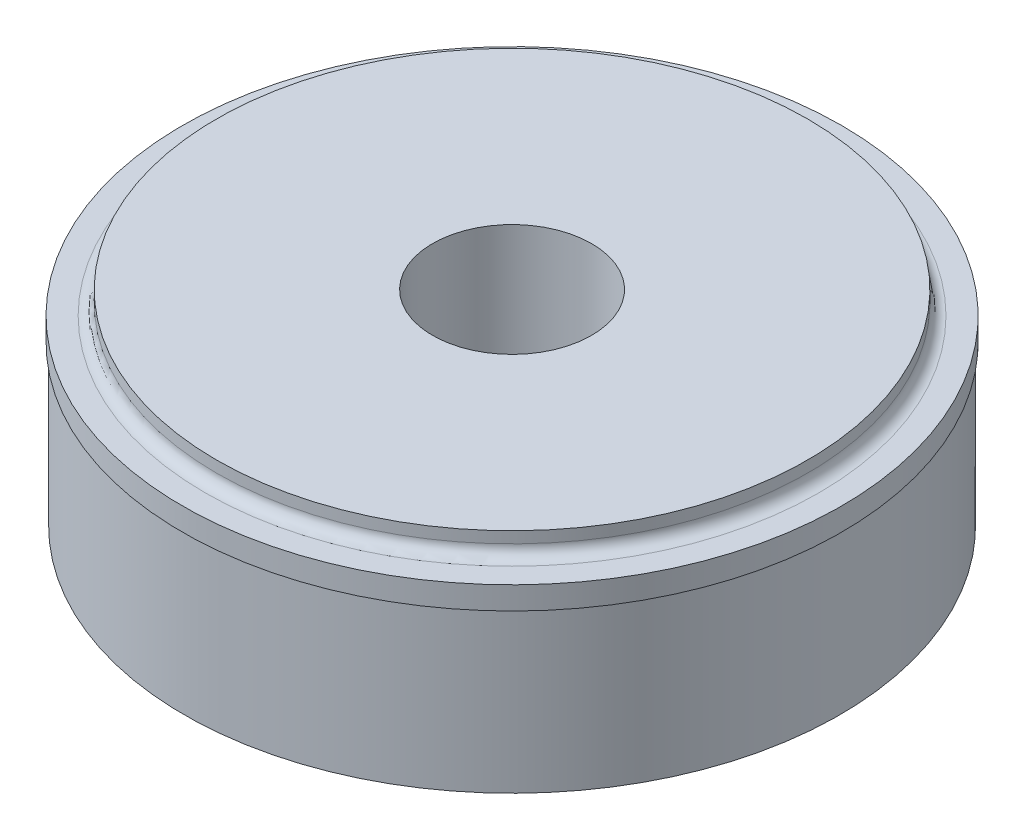
from build123d import *


with BuildPart() as part:
    # 草图1 → 旋转1 (revolve)
    with BuildSketch(Plane(origin=(0, 0, 0), x_dir=(0, 0, -1), z_dir=(1, 0, 0)), mode=Mode.PRIVATE) as revolve_1_sk:
        with BuildLine():
            Line((-17.5, 45), (-17.5, 0))
            Line((-17.5, 0), (-72.1, 0))
            Line((-72.1, 0), (-72.1, 35))
            Line((-72.1, 35), (-72.5, 35))
            Line((-72.5, 35), (-72.5, 40))
            Line((-72.5, 40), (-67.5, 40))
            ThreePointArc((-67.5, 40), (-65.732233047, 40.732233047), (-65, 42.5))
            Line((-65, 42.5), (-65, 45))
            Line((-65, 45), (-17.5, 45))
        make_face()
    revolve(revolve_1_sk.sketch.rotate(Axis((0, 0, 0), (0, 1, 0)), 180), axis=Axis((0, 0, 0), (0, 1, 0)))


solid = part.part
